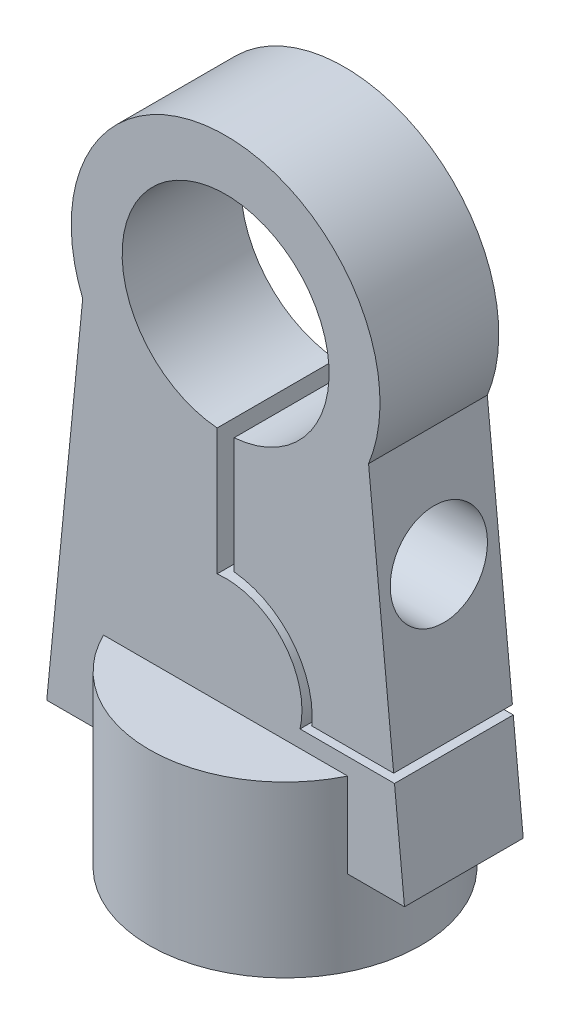
from build123d import *

# Parameters (mm, degrees)
SKETCH1_R                      = 6.1
THICKNESS_DEPTH                = 3.5
BOTNUTCUT_START                = -2
SKETCH2_R                      = 2.85
BOTNUTCUT_DEPTH                = 2.6
SKETCH3_R                      = 1.55
BOTSCREWCUT_DEPTH              = 2
CUT_EXTRUDE1_START             = -7
CUT_EXTRUDE1_DEPTH             = 7
RAILNUTCUT_START               = -2
RAILNUTCUT_DEPTH               = 2.6
SKETCH7_R                      = 1.55
RAILSCREWCUT_DEPTH             = 2.6
RAILSCREWCUT_DIRECTION_2_REACH = 53.909
RAILNUTHEADCUT_REACH           = 56.409
RAILNUTHEADCUT_START           = -2.5
SKETCH8_R                      = 2.85
SKETCH9_W                      = 7
SKETCH9_H                      = 0.5
MOVEMENTCUT_DEPTH              = 7
SKETCH10_R                     = 4.5
BOSS_EXTRUDE1_DEPTH            = 3.5
CUT_EXTRUDE2_START             = -25
SKETCH11_W                     = 40
SKETCH11_H                     = 25
CUT_EXTRUDE2_DEPTH             = 25
SKETCH12_R                     = 8
BOSS_EXTRUDE2_DEPTH            = 10
CUT_EXTRUDE3_START             = -3
CUT_EXTRUDE3_DEPTH             = 4.1
SKETCH14_R                     = 2.55
CUT_EXTRUDE4_DEPTH             = 15
CUT_EXTRUDE5_REACH             = 34.79
SKETCH15_R                     = 1.55
CUT_EXTRUDE6_REACH             = 42.09
CUT_EXTRUDE6_START             = -7.3
SKETCH16_R                     = 2.85
CUT_EXTRUDE7_START             = -3
CUT_EXTRUDE7_DEPTH             = 2.6


with BuildPart() as part:
    # Sketch1 → Thickness (new, symmetric)
    with BuildSketch(Plane.XY):
        with BuildLine():
            Line((-13, -50), (13, -50))
            Line((13, -50), (8.424323952, -3.441041405))
            ThreePointArc((8.424323952, -3.441041405), (0, 9.1), (-8.424323952, -3.441041405))
            Line((-8.424323952, -3.441041405), (-13, -50))
        make_face()
        Circle(SKETCH1_R, mode=Mode.SUBTRACT)
    extrude(amount=THICKNESS_DEPTH, both=True)

    # Sketch2 → BotNutCut (cut)
    with BuildSketch(Plane.XZ.offset(50).offset(BOTNUTCUT_START)):
        with Locations((-7.5, 0)):
            Circle(SKETCH2_R)
        with BuildLine():
            Line((-10.790896534, 2.85), (-10.790896534, 0))
            Line((-10.790896534, 0), (-9.968172361, -1.42500007))
            ThreePointArc((-9.968172361, -1.42500007), (-9.96817242, 1.424999968), (-7.499999995, 2.85))
            Line((-7.499999995, 2.85), (-10.790896534, 2.85))
        make_face()
        with BuildLine():
            Line((-4.209103466, 2.85), (-7.499999995, 2.85))
            ThreePointArc((-7.499999995, 2.85), (-5.484745672, 2.015254324), (-4.65, 0))
            ThreePointArc((-4.65, 0), (-4.747111384, -0.737634237), (-5.031827556, -1.424999925))
            Line((-5.031827556, -1.424999925), (-4.209103466, 0))
            Line((-4.209103466, 0), (-4.209103466, 2.85))
        make_face()
        with BuildLine():
            ThreePointArc((-5.031827556, -1.424999925), (-6.074999963, -2.468172379), (-7.5, -2.85))
            Line((-7.5, -2.85), (-5.854551733, -2.85))
            Line((-5.854551733, -2.85), (-5.031827556, -1.424999925))
        make_face()
        with BuildLine():
            ThreePointArc((-7.5, -2.85), (-8.924999965, -2.468172421), (-9.968172361, -1.42500007))
            Line((-9.968172361, -1.42500007), (-9.145448267, -2.85))
            Line((-9.145448267, -2.85), (-7.5, -2.85))
        make_face()
        with BuildLine():
            ThreePointArc((7.5, -2.85), (6.074999995, -2.468172398), (5.031827593, -1.42499999))
            Line((5.031827593, -1.42499999), (5.854551733, -2.85))
            Line((5.854551733, -2.85), (7.5, -2.85))
        make_face()
        with BuildLine():
            ThreePointArc((9.968172375, -1.425000045), (8.924999978, -2.468172414), (7.5, -2.85))
            Line((7.5, -2.85), (9.145448267, -2.85))
            Line((9.145448267, -2.85), (9.968172375, -1.425000045))
        make_face()
        with BuildLine():
            Line((10.790896534, 2.85), (7.5, 2.85))
            ThreePointArc((7.5, 2.85), (9.515254326, 2.015254326), (10.35, 0))
            ThreePointArc((10.35, 0), (10.252888598, -0.737634304), (9.968172375, -1.425000045))
            Line((9.968172375, -1.425000045), (10.790896534, 0))
            Line((10.790896534, 0), (10.790896534, 2.85))
        make_face()
        with BuildLine():
            Line((4.209103466, 2.85), (4.209103466, 0))
            Line((4.209103466, 0), (5.031827593, -1.42499999))
            ThreePointArc((5.031827593, -1.42499999), (5.031827602, 1.425000005), (7.5, 2.85))
            Line((7.5, 2.85), (4.209103466, 2.85))
        make_face()
        with Locations((7.5, 0)):
            Circle(SKETCH2_R)
    extrude(amount=-BOTNUTCUT_DEPTH, mode=Mode.SUBTRACT)

    # Sketch3 → BotScrewCut (cut)
    with BuildSketch(Plane.XZ.offset(50)):
        with Locations(Location((-7.5, 0, 0), (0, 0, 270))):
            Circle(SKETCH3_R)
        with Locations(Location((7.5, 0, 0), (0, 0, 270))):
            Circle(SKETCH3_R)
    extrude(amount=-BOTSCREWCUT_DEPTH, mode=Mode.SUBTRACT)

    # Sketch5 → Cut-Extrude1 (cut)
    with BuildSketch(Plane.XY.offset(3.5).offset(CUT_EXTRUDE1_START)):
        with BuildLine():
            ThreePointArc((0.5, -6.079473661), (0, -6.1), (-0.5, -6.079473661))
            Line((-0.5, -6.079473661), (-0.5, -12.924568984))
            ThreePointArc((-0.5, -12.924568984), (0, -23.1), (0.5, -12.924568984))
            Line((0.5, -12.924568984), (0.5, -6.079473661))
        make_face()
    extrude(amount=CUT_EXTRUDE1_DEPTH, mode=Mode.SUBTRACT)

    # Sketch6 → RailNutCut (cut)
    with BuildSketch(Plane(origin=(-0.5, 0, 0), x_dir=(0, 0, -1), z_dir=(1, 0, 0)).offset(RAILNUTCUT_START)):
        Polygon((0, -13.290896534), (2.85, -11.645448267), (2.85, -8.354551733), (0, -6.709103466), (-2.85, -6.709103466), (-2.85, -13.290896534), align=None)
    extrude(amount=-RAILNUTCUT_DEPTH, mode=Mode.SUBTRACT)

    # Sketch7 → RailScrewCut (cut)
    with BuildSketch(Plane(origin=(-0.5, 0, 0), x_dir=(0, 0, -1), z_dir=(1, 0, 0))):
        with Locations(Location((0, -10, 0), (0, 0, 270))):
            Circle(SKETCH7_R)
    extrude(amount=-RAILSCREWCUT_DEPTH, mode=Mode.SUBTRACT)

    # RailScrewCut direction 2: up to this plane
    railscrewcut_direction_2_end = Plane(origin=(13, -50, 3.5), z_dir=(-0.9952055153223801, -0.09780583966162733, 0))
    # Sketch7 → RailScrewCut direction 2 (cut, up to the surface)
    with BuildSketch(Plane(origin=(-0.5, 0, 0), x_dir=(0, 0, -1), z_dir=(1, 0, 0)), mode=Mode.PRIVATE) as railscrewcut_direction_2_sk1:
        with Locations(Location((0, -10, 0), (0, 0, 270))):
            Circle(SKETCH7_R)
    railscrewcut_direction_2_tool1 = split(extrude(railscrewcut_direction_2_sk1.sketch, amount=RAILSCREWCUT_DIRECTION_2_REACH, mode=Mode.PRIVATE), bisect_by=railscrewcut_direction_2_end, keep=Keep.BOTH, mode=Mode.PRIVATE)
    add(railscrewcut_direction_2_tool1.solids().sort_by_distance((-0.5, -10, 0))[0], mode=Mode.SUBTRACT)

    # RailNutHeadCut: up to this plane
    railnutheadcut_end = Plane(origin=(13, -50, 3.5), z_dir=(-0.9952055153223801, -0.09780583966162733, 0))
    # Sketch8 → RailNutHeadCut (cut, up to the surface)
    with BuildSketch(Plane.ZY.offset(-0.5).offset(RAILNUTHEADCUT_START), mode=Mode.PRIVATE) as railnutheadcut_sk1:
        with Locations(Location((0, -10, 0), (0, 0, 270))):
            Circle(SKETCH8_R)
    railnutheadcut_tool1 = split(extrude(railnutheadcut_sk1.sketch, amount=-RAILNUTHEADCUT_REACH, mode=Mode.PRIVATE), bisect_by=railnutheadcut_end, keep=Keep.BOTH, mode=Mode.PRIVATE)
    add(railnutheadcut_tool1.solids().sort_by_distance((3, -10, 0))[0], mode=Mode.SUBTRACT)

    # Sketch9 → MovementCut (cut)
    with BuildSketch(Plane.XY.offset(3.5)):
        with Locations((7.5, -18.75)):
            Rectangle(SKETCH9_W, SKETCH9_H)
    extrude(amount=-MOVEMENTCUT_DEPTH, mode=Mode.SUBTRACT)

    # Sketch10 → Boss-Extrude1 (add, symmetric)
    with BuildSketch(Plane.XY):
        with BuildLine():
            Line((-0.5, -13.527864045), (-0.5, -12.924568984))
            ThreePointArc((-0.5, -12.924568984), (-3.780537731, -21.42308844), (5.0009999, -19))
            Line((5.0009999, -19), (4.387482194, -19))
            ThreePointArc((4.387482194, -19), (-3.356217727, -20.997632828), (-0.5, -13.527864045))
        make_face()
        with Locations((0, -18)):
            Circle(SKETCH10_R)
    extrude(amount=BOSS_EXTRUDE1_DEPTH, both=True)

    # Sketch11 → Cut-Extrude2 (cut)
    with BuildSketch(Plane(origin=(0, 0, 0), x_dir=(1, 0, 0), z_dir=(0, 1, 0)).offset(CUT_EXTRUDE2_START)):
        Rectangle(SKETCH11_W, SKETCH11_H)
    extrude(amount=-CUT_EXTRUDE2_DEPTH, mode=Mode.SUBTRACT)

    # Sketch12 → Boss-Extrude2 (add)
    with BuildSketch(Plane(origin=(0, -20, 0), x_dir=(1, 0, 0), z_dir=(0, 1, 0))):
        with Locations(Location((0, 0, 0), (0, 0, 270))):
            Circle(SKETCH12_R)
    extrude(amount=-BOSS_EXTRUDE2_DEPTH)

    # Sketch13 → Cut-Extrude3 (cut)
    with BuildSketch(Plane(origin=(0, -20, 0), x_dir=(1, 0, 0), z_dir=(0, 1, 0)).offset(CUT_EXTRUDE3_START)):
        Polygon((-4.792007234, 0), (-4.792007234, -4.15), (4.792007234, -4.15), (4.792007234, 0), (2.396003617, 4.15), (-2.396003617, 4.15), align=None)
    extrude(amount=-CUT_EXTRUDE3_DEPTH, mode=Mode.SUBTRACT)

    # Sketch14 → Cut-Extrude4 (cut)
    with BuildSketch(Plane.XZ.offset(30)):
        with Locations(Location((0, 0, 0), (0, 0, 270))):
            Circle(SKETCH14_R)
    extrude(amount=-CUT_EXTRUDE4_DEPTH, mode=Mode.SUBTRACT)

    # Cut-Extrude5: up to this plane
    cut_extrude5_end = Plane(origin=(-13, -50, 3.5), z_dir=(0.9952055153223801, -0.09780583966162733, 0))
    # Sketch15 → Cut-Extrude5 (cut, up to the surface)
    with BuildSketch(Plane(origin=(0, 0, 0), x_dir=(0, 0, -1), z_dir=(1, 0, 0)), mode=Mode.PRIVATE) as cut_extrude5_sk1:
        with Locations((0, -19)):
            Circle(SKETCH15_R)
    cut_extrude5_tool1 = split(extrude(cut_extrude5_sk1.sketch, amount=-CUT_EXTRUDE5_REACH, mode=Mode.PRIVATE), bisect_by=cut_extrude5_end, keep=Keep.BOTH, mode=Mode.PRIVATE)
    add(cut_extrude5_tool1.solids().sort_by_distance((0, -19, 0))[0], mode=Mode.SUBTRACT)

    # Cut-Extrude6: up to this plane
    cut_extrude6_end = Plane(origin=(-13, -50, 3.5), z_dir=(0.9952055153223801, -0.09780583966162733, 0))
    # Sketch16 → Cut-Extrude6 (cut, up to the surface)
    with BuildSketch(Plane(origin=(0, 0, 0), x_dir=(0, 0, -1), z_dir=(1, 0, 0)).offset(CUT_EXTRUDE6_START), mode=Mode.PRIVATE) as cut_extrude6_sk1:
        with Locations((0, -19)):
            Circle(SKETCH16_R)
    cut_extrude6_tool1 = split(extrude(cut_extrude6_sk1.sketch, amount=-CUT_EXTRUDE6_REACH, mode=Mode.PRIVATE), bisect_by=cut_extrude6_end, keep=Keep.BOTH, mode=Mode.PRIVATE)
    add(cut_extrude6_tool1.solids().sort_by_distance((-7.3, -19, 0))[0], mode=Mode.SUBTRACT)

    # Sketch17 → Cut-Extrude7 (cut)
    with BuildSketch(Plane(origin=(0, 0, 0), x_dir=(0, 0, -1), z_dir=(1, 0, 0)).offset(CUT_EXTRUDE7_START)):
        Polygon((-2.85, -15.709103466), (-2.85, -22.290896534), (0, -22.290896534), (2.85, -20.645448267), (2.85, -17.354551733), (0, -15.709103466), align=None)
    extrude(amount=-CUT_EXTRUDE7_DEPTH, mode=Mode.SUBTRACT)


solid = part.part
